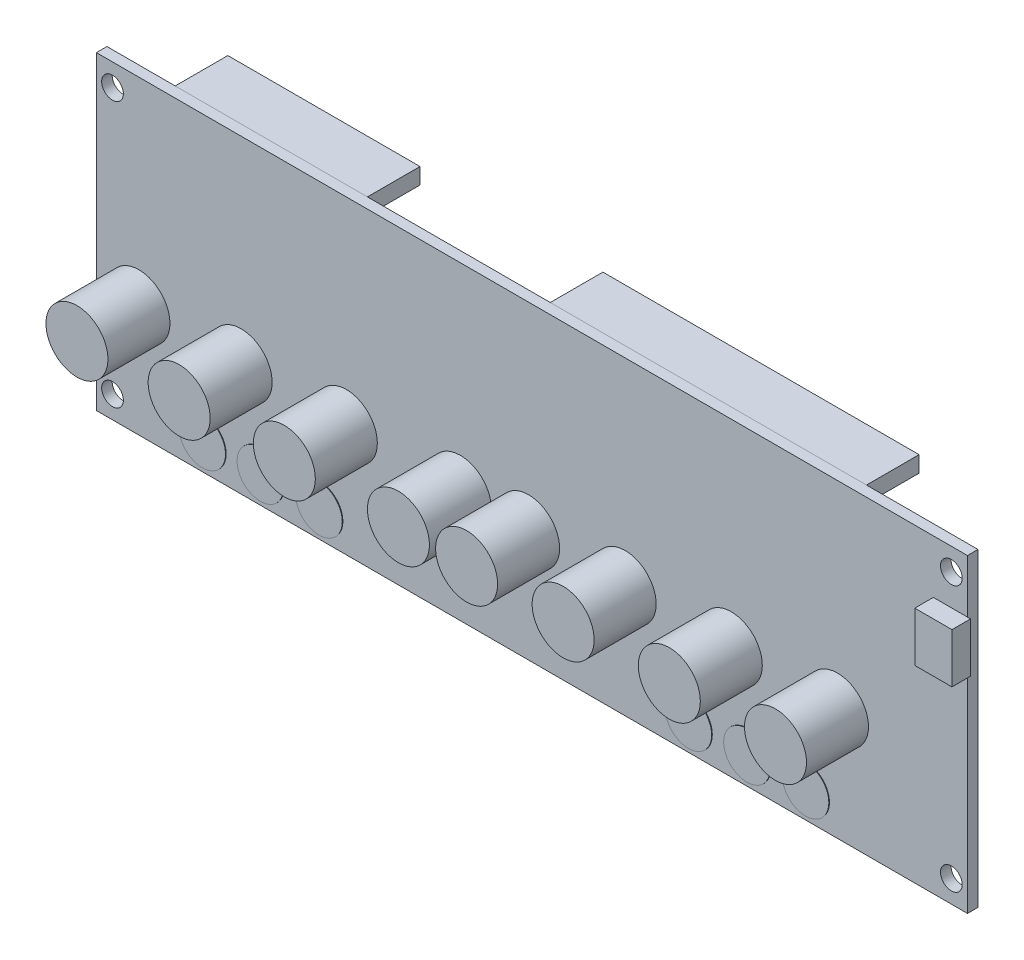
from build123d import *

# Parameters (mm, degrees)
SKETCH1_W                = 140.5
SKETCH1_H                = 50
BOSS_EXTRUDE1_DEPTH      = 1.7
BOSS_EXTRUDE2_START      = 1.7
SKETCH1_3_R              = 5
BOSS_EXTRUDE2_DEPTH      = 10
BOSS_EXTRUDE3_START      = 1.7
SKETCH1_4_W              = 6
SKETCH1_4_H              = 8
BOSS_EXTRUDE3_DEPTH      = 3
SKETCH1_5_R              = 1.75
CUT_EXTRUDE1_DEPTH       = 76.943745628
SKETCH1_6_W              = 31
SKETCH1_6_H              = 2.59
SKETCH1_6_W_2            = 51
BOSS_EXTRUDE4_DEPTH      = 8.5
BOSS_EXTRUDE5_DEPTH      = 1.8
BOSS_EXTRUDE5_DEPTH_BACK = 0.1
SKETCH1_7_R              = 3.75


with BuildPart() as part:
    # Sketch1 → Boss-Extrude1 (new body)
    with BuildSketch(Plane.XY):
        Rectangle(SKETCH1_W, SKETCH1_H)
    extrude(amount=BOSS_EXTRUDE1_DEPTH)

    # Sketch1<3> → Boss-Extrude2 (add)
    with BuildSketch(Plane.XY.offset(BOSS_EXTRUDE2_START)):
        with Locations((-46.900113977, -6.9)):
            Circle(SKETCH1_3_R)
        with Locations((-63.386837135, -6.9)):
            Circle(SKETCH1_3_R)
        with Locations((-29.934803427, -6.9)):
            Circle(SKETCH1_3_R)
        with Locations((-11.533630076, -6.9)):
            Circle(SKETCH1_3_R)
        with Locations((-0.534156135, -6.9)):
            Circle(SKETCH1_3_R)
        with Locations((15.035822711, -6.9)):
            Circle(SKETCH1_3_R)
        with Locations((32.159770987, -6.9)):
            Circle(SKETCH1_3_R)
        with Locations((49.283975389, -6.9)):
            Circle(SKETCH1_3_R)
    extrude(amount=BOSS_EXTRUDE2_DEPTH)

    # Sketch1<4> → Boss-Extrude3 (add)
    with BuildSketch(Plane.XY.offset(BOSS_EXTRUDE3_START)):
        with Locations((67.75, 12.4)):
            Rectangle(SKETCH1_4_W, SKETCH1_4_H)
    extrude(amount=BOSS_EXTRUDE3_DEPTH)

    # Sketch1<5> → Cut-Extrude1 (cut, through all)
    with BuildSketch(Plane.XY):
        with Locations((-67.65, 21.4)):
            Circle(SKETCH1_5_R)
        with Locations(Location((67.65, 21.4, 0), (0, 0, 180))):
            Circle(SKETCH1_5_R)
        with Locations(Location((-67.65, -21.4, 0), (0, 0, 180))):
            Circle(SKETCH1_5_R)
        with Locations((67.65, -21.4)):
            Circle(SKETCH1_5_R)
    extrude(amount=CUT_EXTRUDE1_DEPTH, mode=Mode.SUBTRACT)

    # Sketch1<6> → Boss-Extrude4 (add)
    with BuildSketch(Plane.XY):
        with Locations((-43.75, 23.695)):
            Rectangle(SKETCH1_6_W, SKETCH1_6_H)
        with Locations((26.75, 23.695)):
            Rectangle(SKETCH1_6_W_2, SKETCH1_6_H)
    extrude(amount=-BOSS_EXTRUDE4_DEPTH)

    # Sketch1<7> → Boss-Extrude5 (add, two sides: drawn at the far end of the back side and taken through both)
    with BuildSketch(Plane.XY.offset(-BOSS_EXTRUDE5_DEPTH_BACK)):
        with Locations((-53.074008795, -20.6)):
            Circle(SKETCH1_7_R)
        with Locations((-43.706865007, -20.6)):
            Circle(SKETCH1_7_R)
        with Locations((-34.242336243, -20.6)):
            Circle(SKETCH1_7_R)
        with Locations((25.343402234, -20.6)):
            Circle(SKETCH1_7_R)
        with Locations((34.779018473, -20.6)):
            Circle(SKETCH1_7_R)
        with Locations((44.237672005, -20.6)):
            Circle(SKETCH1_7_R)
    extrude(amount=BOSS_EXTRUDE5_DEPTH + BOSS_EXTRUDE5_DEPTH_BACK)


solid = part.part
